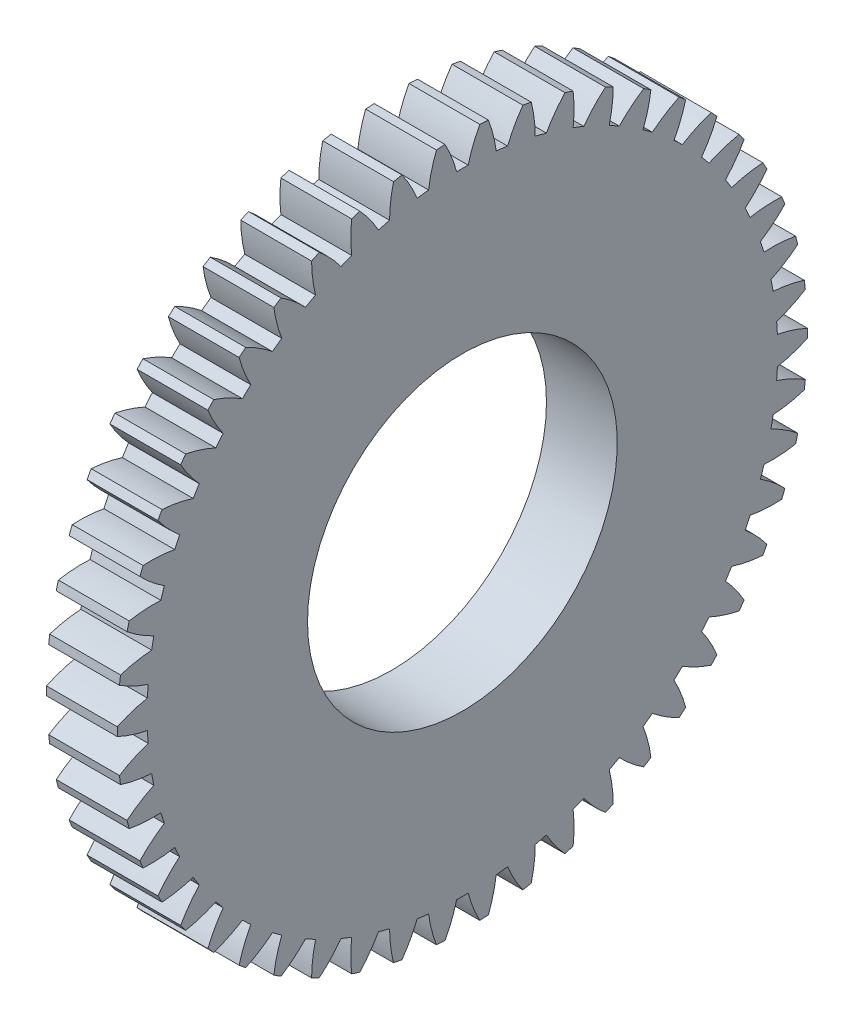
from build123d import *

# Parameters (mm, degrees)
BASPROSKE_W     = 8
BASPROSKE_H     = 39
TOOTHCUT_DEPTH  = 56.731499172
TEETHCUTS_COUNT = 50
TEETHCUTS_ANGLE = 352.8
BORSKE_R        = 17.5
BORE_DEPTH      = 50.0000508


with BuildPart() as part:
    # BasProSke → Base-Revolve (revolve)
    with BuildSketch(Plane(origin=(0, 0, 0), x_dir=(1, 0, 0), z_dir=(0, 1, 0)), mode=Mode.PRIVATE) as base_revolve_sk:
        with Locations((4, 19.5)):
            Rectangle(BASPROSKE_W, BASPROSKE_H)
    revolve(base_revolve_sk.sketch.rotate(Axis((-10, 0, 0), (1, 0, 0)), 180), axis=Axis((-10, 0, 0), (1, 0, 0)))

    # TooCutSke → ToothCut (cut, through all)
    with BuildSketch(Plane(origin=(0, 0, 0), x_dir=(0, 0, -1), z_dir=(1, 0, 0))):
        with BuildLine():
            ThreePointArc((0.649974317, 35.618069984), (0, 35.624), (-0.649974317, 35.618069984))
            ThreePointArc((-0.649974317, 35.618069984), (-1.213667282, 37.336773563), (-1.980135572, 38.975131921))
            ThreePointArc((-1.980135572, 38.975131921), (0, 39.0254), (1.980135572, 38.975131921))
            ThreePointArc((1.980135572, 38.975131921), (1.213667282, 37.336773563), (0.649974317, 35.618069984))
        make_face()
    toothcut = extrude(amount=TOOTHCUT_DEPTH, mode=Mode.SUBTRACT)

    # TeethCuts: ToothCut ×50 about axis
    teethcuts_axis = Axis((-10, 0, 0), (1, 0, 0))
    for i in range(1, TEETHCUTS_COUNT):
        add(toothcut.rotate(teethcuts_axis, i * TEETHCUTS_ANGLE / (TEETHCUTS_COUNT - 1)), mode=Mode.SUBTRACT)

    # BorSke → Bore (cut, symmetric)
    with BuildSketch(Plane(origin=(0, 0, 0), x_dir=(0, 0, -1), z_dir=(1, 0, 0))):
        with Locations(Location((0, 0, 0), (0, 0, 180))):
            Circle(BORSKE_R)
    extrude(amount=BORE_DEPTH, both=True, mode=Mode.SUBTRACT)


solid = part.part
